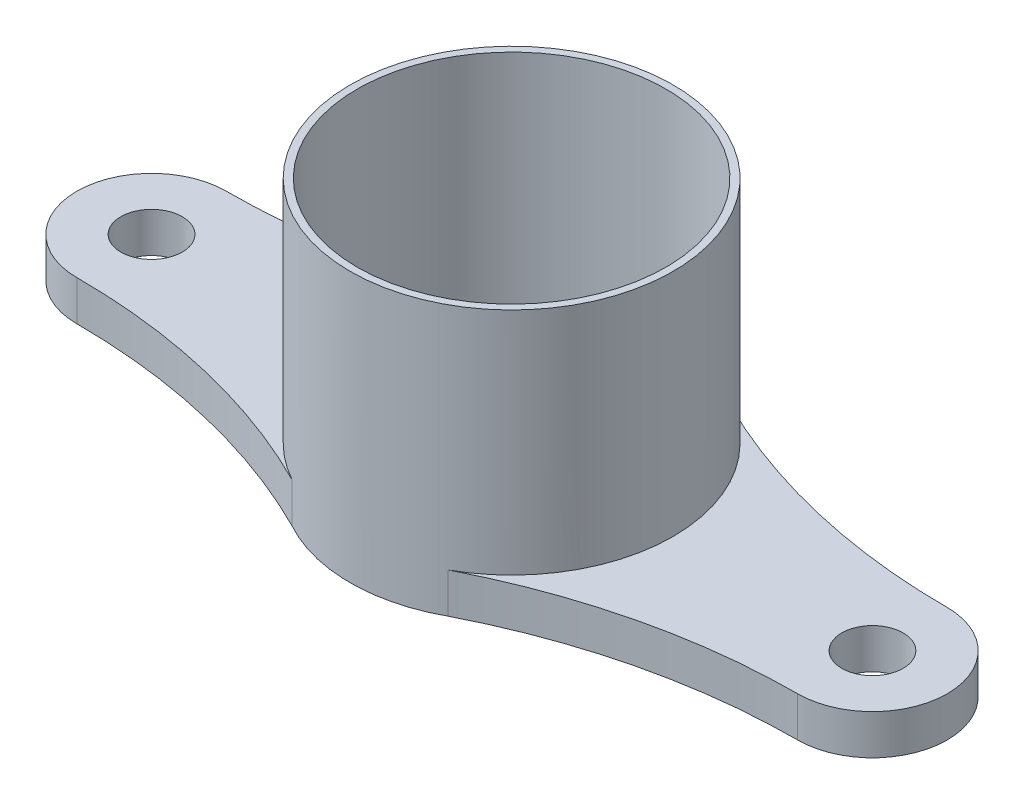
from build123d import *

# Parameters (mm, degrees)
SKETCH1_R           = 1.15
SKETCH1_R_2         = 6.05
SKETCH1_R_3         = 2.85
BOSS_EXTRUDE1_DEPTH = 1.5
SKETCH3_R           = 6.05
SKETCH3_R_2         = 5.781920351
BOSS_EXTRUDE6_DEPTH = 10.1


with BuildPart() as part:
    # Sketch1 → Boss-Extrude1 (new body)
    # profile 1 of 3: a face of its own
    with BuildSketch(Plane(origin=(0, 0, 0), x_dir=(1, 0, 0), z_dir=(0, 1, 0))):
        with BuildLine():
            ThreePointArc((-13.51764198, -2.768029891), (-8.071510009, -3.409034399), (-2.923037011, -5.297013747))
            ThreePointArc((-2.923037011, -5.297013747), (-6.05, 0), (-2.923037011, 5.297013747))
            ThreePointArc((-2.923037011, 5.297013747), (-8.078843984, 3.456352976), (-13.51764198, 2.831970109))
            ThreePointArc((-13.51764198, 2.831970109), (-16.31764198, 0.031970109), (-13.51764198, -2.768029891))
        make_face()
        with Locations(Location((-13.51764198, 0.031970109, 0), (0, 0, 270))):
            Circle(SKETCH1_R, mode=Mode.SUBTRACT)
    # profile 2 of 3: a face of its own
    with BuildSketch(Plane(origin=(0, 0, 0), x_dir=(1, 0, 0), z_dir=(0, 1, 0))):
        Circle(SKETCH1_R_2)
        with Locations(Location((0, 0, 0), (0, 0, 270))):
            Circle(SKETCH1_R_3, mode=Mode.SUBTRACT)
    # profile 3 of 3: a face of its own
    with BuildSketch(Plane(origin=(0, 0, 0), x_dir=(1, 0, 0), z_dir=(0, 1, 0))):
        with BuildLine():
            ThreePointArc((2.923037011, -5.297013747), (8.053384371, -3.409091417), (13.48235802, -2.768029891))
            ThreePointArc((13.48235802, -2.768029891), (16.28235802, 0.031970109), (13.48235802, 2.831970109))
            ThreePointArc((13.48235802, 2.831970109), (8.060741556, 3.456405922), (2.923037011, 5.297013747))
            ThreePointArc((2.923037011, 5.297013747), (5.209936368, 3.07555898), (6.05, 0))
            ThreePointArc((6.05, 0), (5.209936368, -3.07555898), (2.923037011, -5.297013747))
        make_face()
        with Locations(Location((13.48235802, 0.031970109, 0), (0, 0, 270))):
            Circle(SKETCH1_R, mode=Mode.SUBTRACT)
    extrude(amount=BOSS_EXTRUDE1_DEPTH)

    # Sketch3 → Boss-Extrude6 (add)
    with BuildSketch(Plane(origin=(0, 0, 0), x_dir=(1, 0, 0), z_dir=(0, 1, 0))):
        with Locations(Location((0, 0, 0), (0, 0, 118.891114763))):
            Circle(SKETCH3_R)
        with Locations(Location((0, 0, 0), (0, 0, 270))):
            Circle(SKETCH3_R_2, mode=Mode.SUBTRACT)
    extrude(amount=BOSS_EXTRUDE6_DEPTH)


solid = part.part
